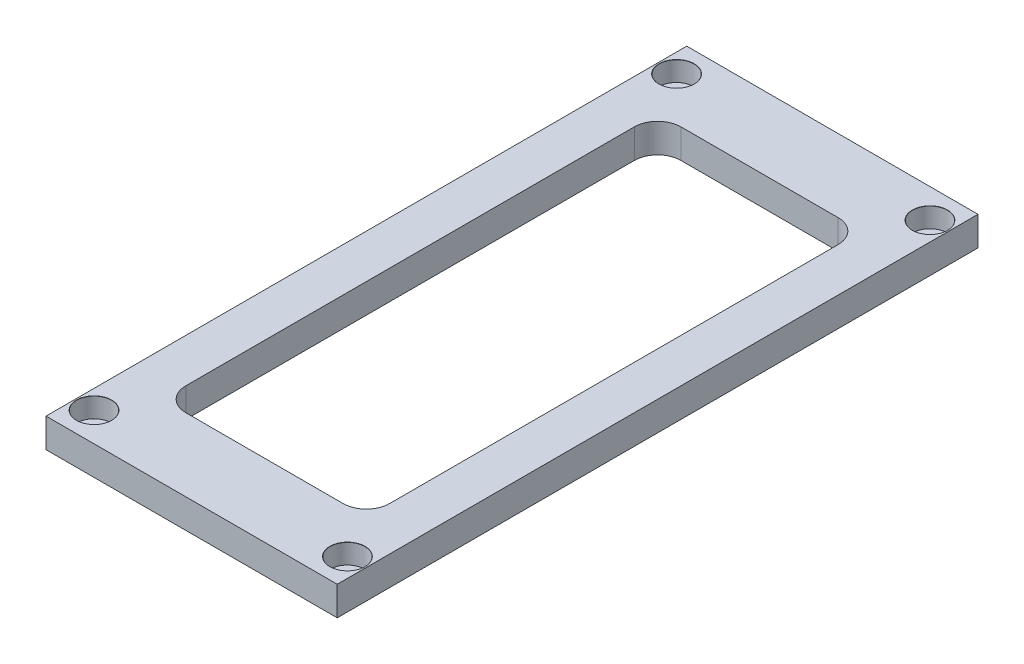
from build123d import *

# Parameters (mm, degrees)
SKETCH1_W                                    = 50
SKETCH1_H                                    = 110
BOSS_EXTRUDE1_DEPTH                          = 5
CBORE_FOR_M3_HEXAGON_SOCKET_HEAD_CAP_2_COUNT = 2
CBORE_FOR_M3_HEXAGON_SOCKET_HEAD_CAP_2_PITCH = 43.5
CBORE_FOR_M3_HEXAGON_SOCKET_HEAD_CAP_3_COUNT = 2
CBORE_FOR_M3_HEXAGON_SOCKET_HEAD_CAP_3_PITCH = 100
CBORE_FOR_M3_HEXAGON_SOCKET_HEAD_CAP_4_COUNT = 2
CBORE_FOR_M3_HEXAGON_SOCKET_HEAD_CAP_4_PITCH = 109.051593294
SKETCH5_W                                    = 35
SKETCH5_H                                    = 85
CUT_EXTRUDE1_DEPTH                           = 61.621778265
FILLET1_R                                    = 4


with BuildPart() as part:
    # Sketch1 → Boss-Extrude1 (new body)
    with BuildSketch(Plane(origin=(0, 0, 0), x_dir=(1, 0, 0), z_dir=(0, 1, 0))):
        Rectangle(SKETCH1_W, SKETCH1_H)
    extrude(amount=BOSS_EXTRUDE1_DEPTH)

    # Sketch4 → CBORE for M3 Hexagon socket head cap screws1 (revolve, cut)
    with BuildSketch(Plane(origin=(-21.75, 5, -50), x_dir=(0, 0, 1), z_dir=(1, 0, 0))):
        Polygon((0, 0), (0, 10.96137699), (1.6, 10), (1.6, 3.4), (3, 3.4), (3, 0.025), (3.025, 0), align=None)
    cbore_for_m3_hexagon_socket_head_cap_scr = revolve(axis=Axis((-21.75, 11.35, -50), (0, -1, 0)), mode=Mode.SUBTRACT)

    # CBORE for M3 Hexagon socket head cap 2: CBORE for M3 Hexagon socket head cap screws1 ×2
    with Locations(*[(i * CBORE_FOR_M3_HEXAGON_SOCKET_HEAD_CAP_2_PITCH, 0, 0) for i in range(1, CBORE_FOR_M3_HEXAGON_SOCKET_HEAD_CAP_2_COUNT)]):
        add(cbore_for_m3_hexagon_socket_head_cap_scr, mode=Mode.SUBTRACT)

    # CBORE for M3 Hexagon socket head cap 3: CBORE for M3 Hexagon socket head cap screws1 ×2
    with Locations(*[(0, 0, i * CBORE_FOR_M3_HEXAGON_SOCKET_HEAD_CAP_3_PITCH) for i in range(1, CBORE_FOR_M3_HEXAGON_SOCKET_HEAD_CAP_3_COUNT)]):
        add(cbore_for_m3_hexagon_socket_head_cap_scr, mode=Mode.SUBTRACT)

    # CBORE for M3 Hexagon socket head cap 4: CBORE for M3 Hexagon socket head cap screws1 ×2
    with Locations(*[Vector(0.3988937592379055, 0, 0.9169971476733457) * (i * CBORE_FOR_M3_HEXAGON_SOCKET_HEAD_CAP_4_PITCH) for i in range(1, CBORE_FOR_M3_HEXAGON_SOCKET_HEAD_CAP_4_COUNT)]):
        add(cbore_for_m3_hexagon_socket_head_cap_scr, mode=Mode.SUBTRACT)

    # Sketch5 → Cut-Extrude1 (cut, through all)
    with BuildSketch(Plane(origin=(0, 5, 0), x_dir=(1, 0, 0), z_dir=(0, 1, 0))):
        Rectangle(SKETCH5_W, SKETCH5_H)
    extrude(amount=-CUT_EXTRUDE1_DEPTH, mode=Mode.SUBTRACT)

    # Fillet1
    fillet1_edges = [part.edges().sort_by_distance(p)[0] for p in [
        (-17.5, 2.5, 42.5),
        (-17.5, 2.5, -42.5),
        (17.5, 2.5, -42.5),
        (17.5, 2.5, 42.5),
    ]]
    fillet(fillet1_edges, radius=FILLET1_R)


solid = part.part
